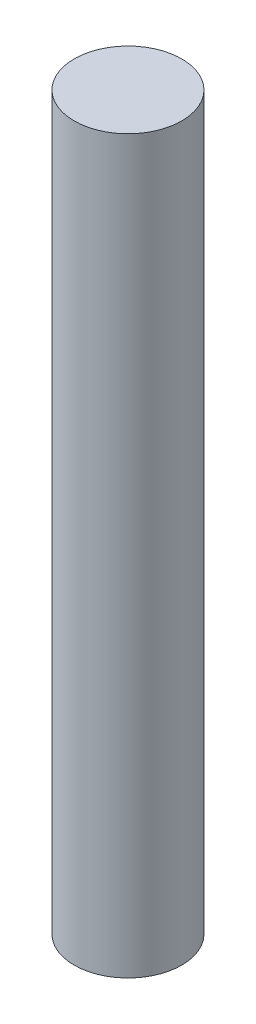
from build123d import *

# Parameters (mm, degrees)
CROQUIS1_R              = 2.5
SALIENTE_EXTRUIR1_DEPTH = 34


with BuildPart() as part:
    # Croquis1 → Saliente-Extruir1 (new body)
    with BuildSketch(Plane(origin=(0, 0, 0), x_dir=(1, 0, 0), z_dir=(0, 1, 0))):
        with Locations(Location((0, 0, 0), (0, 0, 270))):
            Circle(CROQUIS1_R)
    extrude(amount=SALIENTE_EXTRUIR1_DEPTH)


solid = part.part
